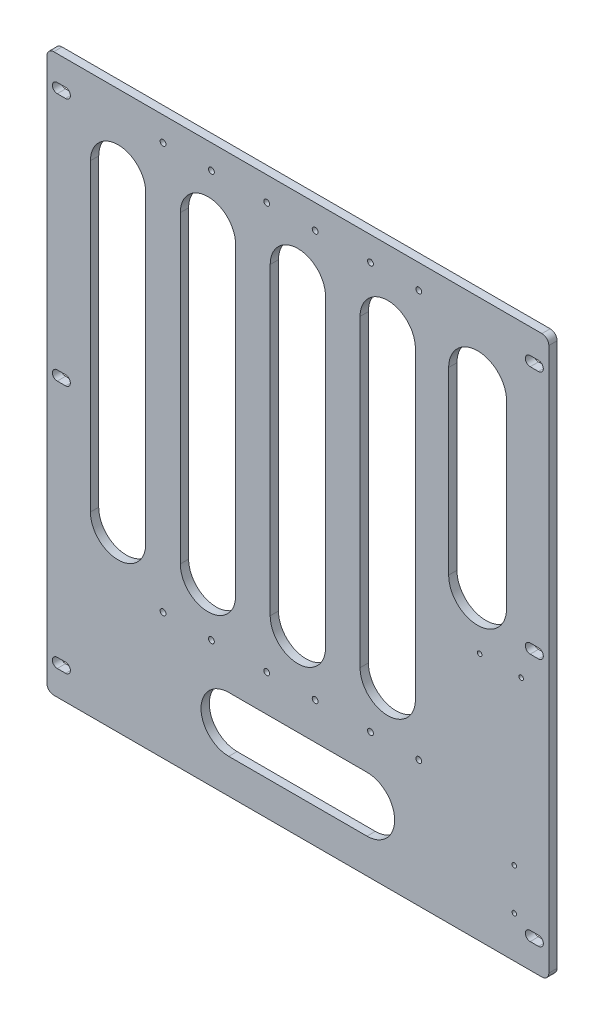
from build123d import *

# Parameters (mm, degrees)
SKETCH_1_W             = 363
SKETCH_1_H             = 403
EXTRUDE_1_DEPTH        = 6
FILLET_1_R             = 5
SKETCH_3_R             = 3.5
CUT_EXTRUDE_2_DEPTH    = 10
HOLE_WIZARD_M5_1_D     = 4.2
HOLE_WIZARD_M5_1_DEPTH = 12.4
HOLE_WIZARD_M5_1_TIP   = 1.2618073
CUT_EXTRUDE_3_DEPTH    = 10
CUT_EXTRUDE_4_DEPTH    = 10
CUT_EXTRUDE_5_DEPTH    = 10
HOLE_WIZARD_M4_1_D     = 3.3
HOLE_WIZARD_M4_1_DEPTH = 10.1
HOLE_WIZARD_M4_1_TIP   = 0.991420021


with BuildPart() as part:
    # Sketch 1 → 凸台-拉伸1 (new body)
    with BuildSketch(Plane.XY):
        Rectangle(SKETCH_1_W, SKETCH_1_H)
    extrude(amount=EXTRUDE_1_DEPTH)

    # 圆角1
    fillet_1_edges = [part.edges().sort_by_distance(p)[0] for p in [
        (181.5, -201.5, 3),
        (-181.5, -201.5, 3),
        (-181.5, 201.5, 3),
        (181.5, 201.5, 3),
    ]]
    fillet(fillet_1_edges, radius=FILLET_1_R)

    # 草图3 → 切除-拉伸2 (cut)
    with BuildSketch(Plane.XY.offset(6)):
        with Locations((-171, -180)):
            Circle(SKETCH_3_R)
        with Locations((-171, 180)):
            Circle(SKETCH_3_R)
        with Locations((-171, 0)):
            Circle(SKETCH_3_R)
        with Locations((171, 0)):
            Circle(SKETCH_3_R)
        with Locations((171, 180)):
            Circle(SKETCH_3_R)
        with Locations((171, -180)):
            Circle(SKETCH_3_R)
    extrude(amount=-CUT_EXTRUDE_2_DEPTH, mode=Mode.SUBTRACT)

    # M5 螺纹孔1
    with Locations(Plane.XY.offset(6)):
        with Locations((-97.5, -110), (-62.5, -110), (-97.5, 184), (-62.5, 184), (-22.5, -110), (12.5, -110), (-22.5, 184), (12.5, 184), (52.5, -110), (87.5, -110), (52.5, 184), (87.5, 184)):
            Hole(HOLE_WIZARD_M5_1_D / 2, depth=HOLE_WIZARD_M5_1_DEPTH)
            with Locations((0, 0, -(HOLE_WIZARD_M5_1_DEPTH + HOLE_WIZARD_M5_1_TIP / 2))):  # 118° drill point
                Cone(0, HOLE_WIZARD_M5_1_D / 2, HOLE_WIZARD_M5_1_TIP, mode=Mode.SUBTRACT)

    # 草图6 → 切除-拉伸3 (cut)
    with BuildSketch(Plane.XY.offset(6)):
        with BuildLine():
            Line((-174, 183.5), (-168, 183.5))
            ThreePointArc((-168, 183.5), (-164.5, 180), (-168, 176.5))
            Line((-168, 176.5), (-174, 176.5))
            ThreePointArc((-174, 176.5), (-177.5, 180), (-174, 183.5))
        make_face()
        with BuildLine():
            Line((168, 183.5), (174, 183.5))
            ThreePointArc((174, 183.5), (177.5, 180), (174, 176.5))
            Line((174, 176.5), (168, 176.5))
            ThreePointArc((168, 176.5), (164.5, 180), (168, 183.5))
        make_face()
        with BuildLine():
            Line((168, 3.5), (174, 3.5))
            ThreePointArc((174, 3.5), (177.5, 0), (174, -3.5))
            Line((174, -3.5), (168, -3.5))
            ThreePointArc((168, -3.5), (164.5, 0), (168, 3.5))
        make_face()
        with BuildLine():
            Line((168, -176.5), (174, -176.5))
            ThreePointArc((174, -176.5), (177.5, -180), (174, -183.5))
            Line((174, -183.5), (168, -183.5))
            ThreePointArc((168, -183.5), (164.5, -180), (168, -176.5))
        make_face()
        with BuildLine():
            Line((-174, 3.5), (-168, 3.5))
            ThreePointArc((-168, 3.5), (-164.5, 0), (-168, -3.5))
            Line((-168, -3.5), (-174, -3.5))
            ThreePointArc((-174, -3.5), (-177.5, 0), (-174, 3.5))
        make_face()
        with BuildLine():
            Line((-174, -176.5), (-168, -176.5))
            ThreePointArc((-168, -176.5), (-164.5, -180), (-168, -183.5))
            Line((-168, -183.5), (-174, -183.5))
            ThreePointArc((-174, -183.5), (-177.5, -180), (-174, -176.5))
        make_face()
    extrude(amount=-CUT_EXTRUDE_3_DEPTH, mode=Mode.SUBTRACT)

    # 草图7 → 切除-拉伸4 (cut)
    with BuildSketch(Plane.XY.offset(6)):
        with BuildLine():
            Line((-50, -136.5), (50, -136.5))
            ThreePointArc((50, -136.5), (70, -156.5), (50, -176.5))
            Line((50, -176.5), (-50, -176.5))
            ThreePointArc((-50, -176.5), (-70, -156.5), (-50, -136.5))
        make_face()
    extrude(amount=-CUT_EXTRUDE_4_DEPTH, mode=Mode.SUBTRACT)

    # 草图8 → 切除-拉伸5 (cut)
    with BuildSketch(Plane.XY.offset(6)):
        with BuildLine():
            Line((20, 146.5), (20, -73.5))
            ThreePointArc((20, -73.5), (0, -93.5), (-20, -73.5))
            Line((-20, -73.5), (-20, 146.5))
            ThreePointArc((-20, 146.5), (0, 166.5), (20, 146.5))
        make_face()
        with BuildLine():
            Line((85, 146.5), (85, -73.5))
            ThreePointArc((85, -73.5), (65, -93.5), (45, -73.5))
            Line((45, -73.5), (45, 146.5))
            ThreePointArc((45, 146.5), (65, 166.5), (85, 146.5))
        make_face()
        with BuildLine():
            Line((-150, 146.5), (-150, -73.5))
            ThreePointArc((-150, -73.5), (-130, -93.5), (-110, -73.5))
            Line((-110, -73.5), (-110, 146.5))
            ThreePointArc((-110, 146.5), (-130, 166.5), (-150, 146.5))
        make_face()
        with BuildLine():
            Line((-85, 146.5), (-85, -73.5))
            ThreePointArc((-85, -73.5), (-65, -93.5), (-45, -73.5))
            Line((-45, -73.5), (-45, 146.5))
            ThreePointArc((-45, 146.5), (-65, 166.5), (-85, 146.5))
        make_face()
        with BuildLine():
            Line((150.952961105, 146.5), (150.952961105, 16.5))
            ThreePointArc((150.952961105, 16.5), (130, -4.452961105), (109.047038895, 16.5))
            Line((109.047038895, 16.5), (109.047038895, 146.5))
            ThreePointArc((109.047038895, 146.5), (130, 167.452961105), (150.952961105, 146.5))
        make_face()
    extrude(amount=-CUT_EXTRUDE_5_DEPTH, mode=Mode.SUBTRACT)

    # M4 螺纹孔1
    with Locations(Plane.XY.offset(6)):
        with Locations((156.5, -171.5), (156.5, -141.5), (161.5, -21.5), (131.5, -21.5)):
            Hole(HOLE_WIZARD_M4_1_D / 2, depth=HOLE_WIZARD_M4_1_DEPTH)
            with Locations((0, 0, -(HOLE_WIZARD_M4_1_DEPTH + HOLE_WIZARD_M4_1_TIP / 2))):  # 118° drill point
                Cone(0, HOLE_WIZARD_M4_1_D / 2, HOLE_WIZARD_M4_1_TIP, mode=Mode.SUBTRACT)


solid = part.part
